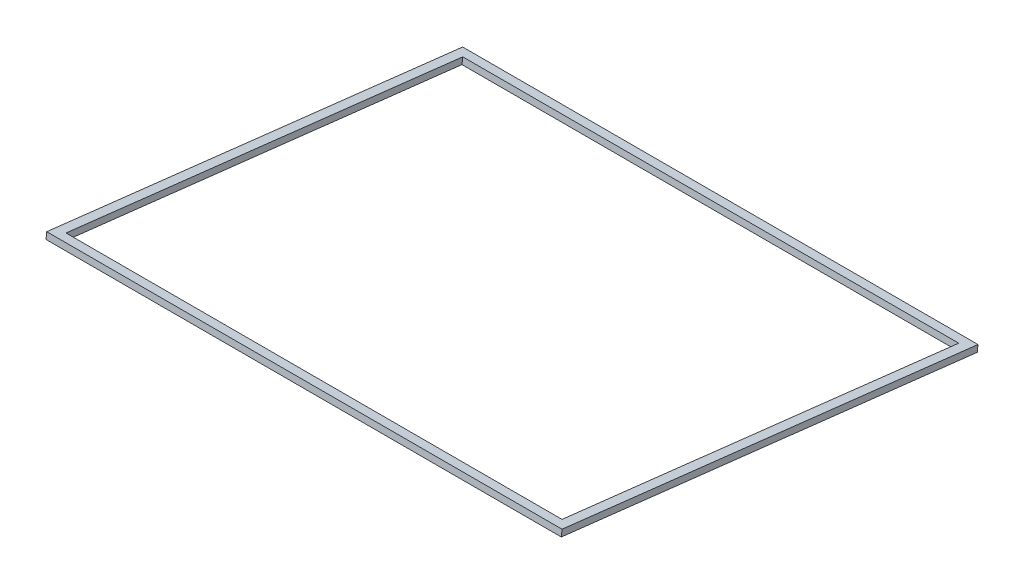
from build123d import *

# Parameters (mm, degrees)
BOSS_EXTRUDE1_START = 116
SKETCH1_W           = 160
SKETCH1_H           = 130
SKETCH1_W_2         = 154
SKETCH1_H_2         = 124
BOSS_EXTRUDE1_DEPTH = 2


with BuildPart() as part:
    # Sketch1 → Boss-Extrude1 (new body)
    with BuildSketch(Plane(origin=(0, 358.879876801, -41.422455829), x_dir=(1, 0, 0), z_dir=(-6.837425950214788e-15, 0.9934047622419533, -0.1146602736566085)).offset(BOSS_EXTRUDE1_START)):
        with Locations((-135, 150.244347434)):
            Rectangle(SKETCH1_W, SKETCH1_H)
        with Locations((-135, 150.244347434)):
            Rectangle(SKETCH1_W_2, SKETCH1_H_2, mode=Mode.SUBTRACT)
    extrude(amount=BOSS_EXTRUDE1_DEPTH)


solid = part.part
